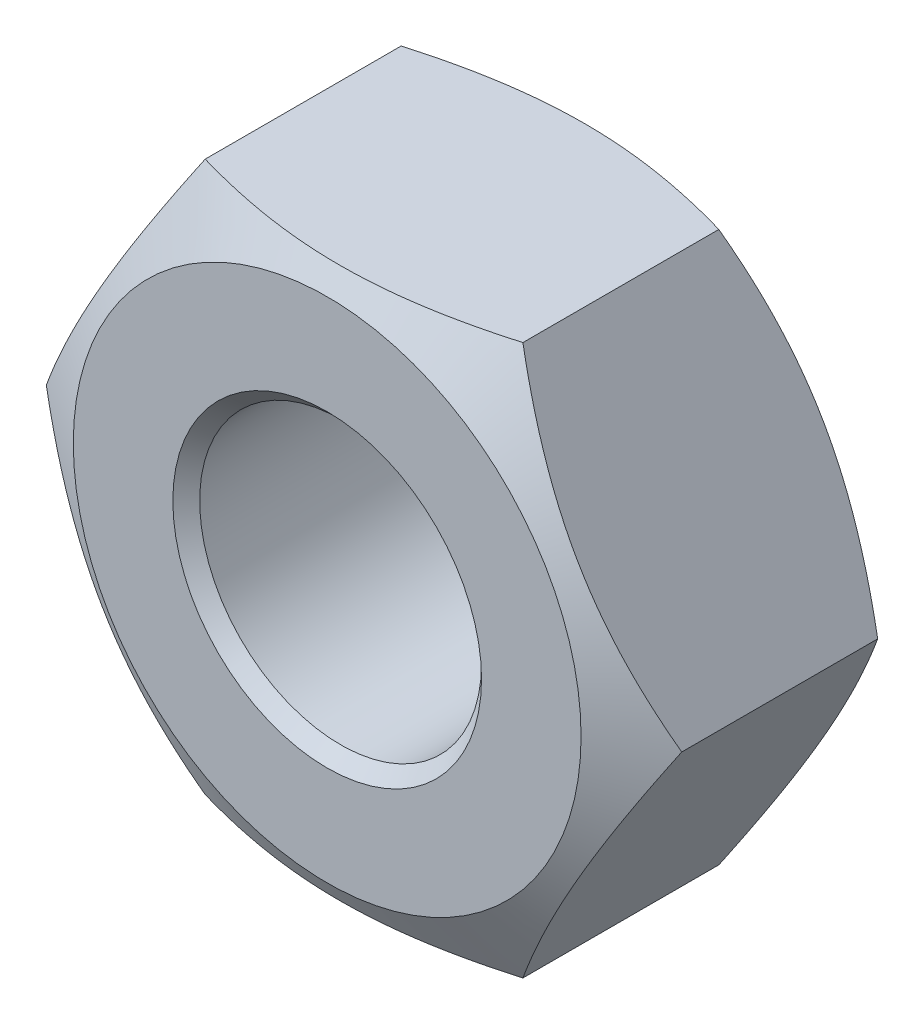
from build123d import *

# Parameters (mm, degrees)
BASE_EXTRUDE_DEPTH         = 20
SZKIC1_OUTSIDE_W           = 72.884
SZKIC1_OUTSIDE_H           = 66.542
SZKIC1_OUTSIDE_R           = 18.915964881
WYTNIJ_WYCI_GNI_CIE1_DEPTH = 3
WYTNIJ_WYCI_GNI_CIE1_DRAFT = -60
SZKIC2_OUTSIDE_W           = 72.884
SZKIC2_OUTSIDE_H           = 66.542
SZKIC2_OUTSIDE_R           = 19.068904069
WYTNIJ_WYCI_GNI_CIE2_DEPTH = 3
WYTNIJ_WYCI_GNI_CIE2_DRAFT = -60
OTW_R_GWINTOWANY_M241_D    = 21
SFAZOWANIE1_SIZE           = 1


with BuildPart() as part:
    # Sketch1 → Base-Extrude (new body)
    with BuildSketch(Plane.XY):
        Polygon((23.671361037, 0), (11.835680518, 20.5), (-11.835680518, 20.5), (-23.671361037, 0), (-11.835680518, -20.5), (11.835680518, -20.5), align=None)
    extrude(amount=BASE_EXTRUDE_DEPTH)


with BuildPart() as wytnij_wyci_gni_cie1_tool:
    # Szkic1 outside → Wytnij-wyciągnięcie1 (with draft: the straight prism first)
    with BuildSketch(Plane.XY.offset(20)):
        Rectangle(SZKIC1_OUTSIDE_W, SZKIC1_OUTSIDE_H)
        Circle(SZKIC1_OUTSIDE_R, mode=Mode.SUBTRACT)
    extrude(amount=-WYTNIJ_WYCI_GNI_CIE1_DEPTH)
    # Wytnij-wyciągnięcie1: the draft: its side faces are tilted about the plane it starts from
    wytnij_wyci_gni_cie1_sides = [wytnij_wyci_gni_cie1_tool.faces().sort_by_distance(p)[0] for p in [
        (0, -33.271, 18.5),
        (36.442, 0, 18.5),
        (0, 33.271, 18.5),
        (-36.442, 0, 18.5),
        (-18.915964881, 0, 18.5),
    ]]
    draft(wytnij_wyci_gni_cie1_sides, Plane.XY.offset(20), WYTNIJ_WYCI_GNI_CIE1_DRAFT)


with BuildPart() as part_1:
    add(part.part)

    # Wytnij-wyciągnięcie1: cut by wytnij_wyci_gni_cie1_tool
    add(wytnij_wyci_gni_cie1_tool.part, mode=Mode.SUBTRACT)


with BuildPart() as wytnij_wyci_gni_cie2_tool:
    # Szkic2 outside → Wytnij-wyciągnięcie2 (with draft: the straight prism first)
    with BuildSketch(Plane(origin=(0, 0, 0), x_dir=(-1, 0, 0), z_dir=(0, 0, -1))):
        Rectangle(SZKIC2_OUTSIDE_W, SZKIC2_OUTSIDE_H)
        Circle(SZKIC2_OUTSIDE_R, mode=Mode.SUBTRACT)
    extrude(amount=-WYTNIJ_WYCI_GNI_CIE2_DEPTH)
    # Wytnij-wyciągnięcie2: the draft: its side faces are tilted about the plane it starts from
    wytnij_wyci_gni_cie2_sides = [wytnij_wyci_gni_cie2_tool.faces().sort_by_distance(p)[0] for p in [
        (0, -33.271, 1.5),
        (-36.442, 0, 1.5),
        (0, 33.271, 1.5),
        (36.442, 0, 1.5),
        (19.068904069, 0, 1.5),
    ]]
    draft(wytnij_wyci_gni_cie2_sides, Plane(origin=(0, 0, 0), x_dir=(-1, 0, 0), z_dir=(0, 0, -1)), WYTNIJ_WYCI_GNI_CIE2_DRAFT)


with BuildPart() as part_2:
    add(part_1.part)

    # Wytnij-wyciągnięcie2: cut by wytnij_wyci_gni_cie2_tool
    add(wytnij_wyci_gni_cie2_tool.part, mode=Mode.SUBTRACT)

    # Otwór gwintowany M241 (through all)
    with Locations(Plane(origin=(0, 0, 0), x_dir=(-1, 0, 0), z_dir=(0, 0, -1))):
        with Locations((0, 0)):
            Hole(OTW_R_GWINTOWANY_M241_D / 2)

    # Sfazowanie1
    sfazowanie1_edges = [part_2.edges().sort_by_distance(p)[0] for p in [
        (-10.5, 0, 0),
        (-10.5, 0, 20),
    ]]
    chamfer(sfazowanie1_edges, length=SFAZOWANIE1_SIZE)


solid = part_2.part
